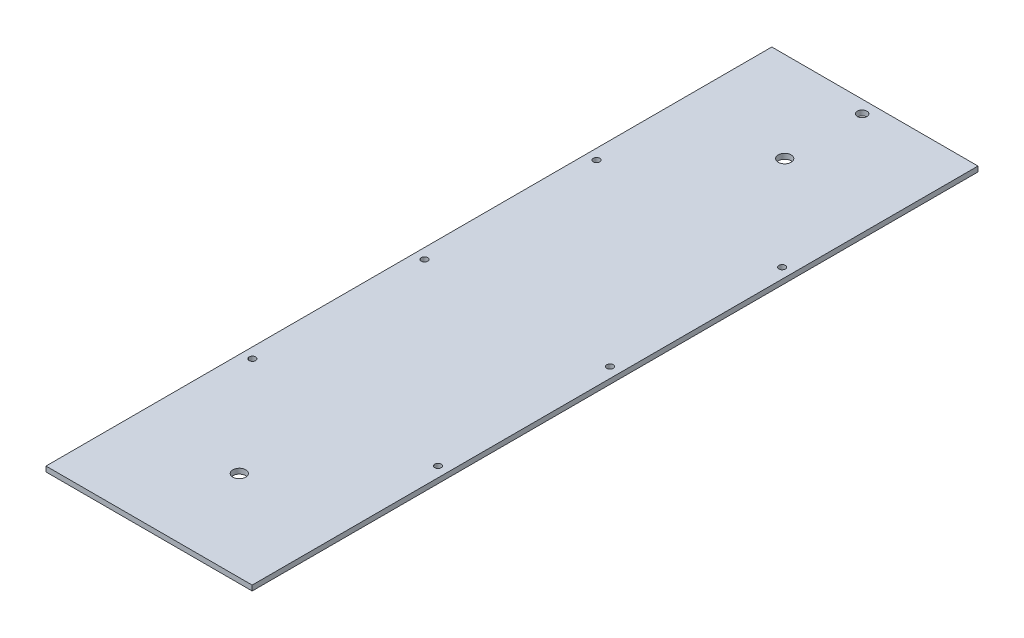
from build123d import *

# Parameters (mm, degrees)
SKETCH1_W               = 80
SKETCH1_H               = 281.62
BOSS_EXTRUDE1_DEPTH     = 2
SKETCH2_R               = 1.85
CUT_EXTRUDE1_DEPTH      = 2
SKETCH3_R               = 1.25
CUT_EXTRUDE2_DEPTH      = 2
LPATTERN1_COUNT         = 3
LPATTERN1_PITCH         = 66.76
MIRROR1_COPY_1_SKETCH_R = 1.25
MIRROR1_COPY_1_DEPTH    = 2
MIRROR1_COPY_2_SKETCH_R = 1.25
MIRROR1_COPY_2_DEPTH    = 2
SKETCH4_R               = 2.5
CUT_EXTRUDE3_DEPTH      = 10


with BuildPart() as part:
    # Sketch1 → Boss-Extrude1 (new body)
    with BuildSketch(Plane(origin=(0, 0, 0), x_dir=(1, 0, 0), z_dir=(0, 1, 0))):
        Rectangle(SKETCH1_W, SKETCH1_H)
    extrude(amount=BOSS_EXTRUDE1_DEPTH)

    # Sketch2 → Cut-Extrude1 (cut)
    with BuildSketch(Plane(origin=(0, 2, 0), x_dir=(1, 0, 0), z_dir=(0, 1, 0))):
        with Locations(Location((0, 135.87, 0), (0, 0, 270))):
            Circle(SKETCH2_R)
    extrude(amount=-CUT_EXTRUDE1_DEPTH, mode=Mode.SUBTRACT)

    # Sketch3 → Cut-Extrude2 (cut)
    with BuildSketch(Plane(origin=(0, 2, 0), x_dir=(1, 0, 0), z_dir=(0, 1, 0))):
        with Locations(Location((-36, 68.81, 0), (0, 0, 270))):
            Circle(SKETCH3_R)
    cut_extrude2 = extrude(amount=-CUT_EXTRUDE2_DEPTH, mode=Mode.SUBTRACT)

    # LPattern1: Cut-Extrude2 ×3
    with Locations(*[(0, 0, i * LPATTERN1_PITCH) for i in range(1, LPATTERN1_COUNT)]):
        add(cut_extrude2, mode=Mode.SUBTRACT)

    # Mirror1: Cut-Extrude2 across plane
    add(cut_extrude2.mirror(Plane(origin=(0, 0, 0), x_dir=(0, 0, 1), z_dir=(1, 0, 0))), mode=Mode.SUBTRACT)

    # Mirror1 copy 1 sketch → Mirror1 copy 1 (cut)
    with BuildSketch(Plane(origin=(0, 2, 66.76), x_dir=(-1, 0, 0), z_dir=(0, 1, 0))):
        with Locations((-36, -68.81)):
            Circle(MIRROR1_COPY_1_SKETCH_R)
    extrude(amount=-MIRROR1_COPY_1_DEPTH, mode=Mode.SUBTRACT)

    # Mirror1 copy 2 sketch → Mirror1 copy 2 (cut)
    with BuildSketch(Plane(origin=(0, 2, 133.52), x_dir=(-1, 0, 0), z_dir=(0, 1, 0))):
        with Locations((-36, -68.81)):
            Circle(MIRROR1_COPY_2_SKETCH_R)
    extrude(amount=-MIRROR1_COPY_2_DEPTH, mode=Mode.SUBTRACT)

    # Sketch4 → Cut-Extrude3 (cut)
    with BuildSketch(Plane(origin=(0, 2, 0), x_dir=(1, 0, 0), z_dir=(0, 1, 0))):
        with Locations(Location((0, 105.81, 0), (0, 0, 270))):
            Circle(SKETCH4_R)
    cut_extrude3 = extrude(amount=-CUT_EXTRUDE3_DEPTH, mode=Mode.SUBTRACT)

    # Mirror2: Cut-Extrude3 across plane
    add(cut_extrude3.mirror(Plane.XY), mode=Mode.SUBTRACT)


solid = part.part
